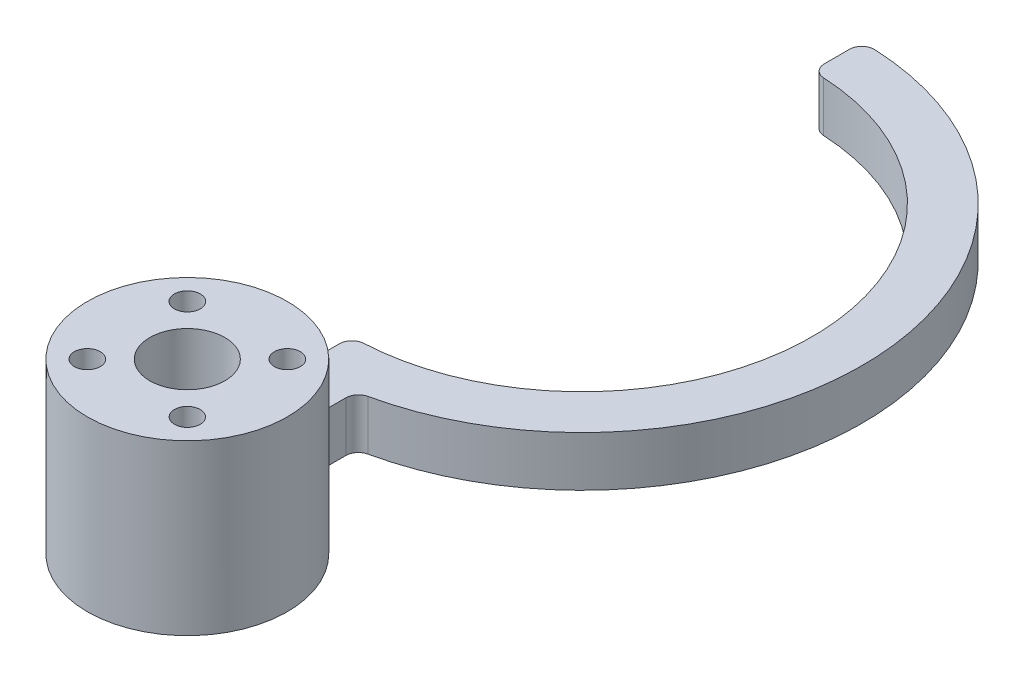
from build123d import *

# Parameters (mm, degrees)
SKETCH1_R           = 2.075
SKETCH1_R_2         = 6.003208263
BOSS_EXTRUDE2_DEPTH = 8
FILLET1_R           = 2
SKETCH2_R           = 16
SKETCH2_R_2         = 2.075
SKETCH2_R_3         = 6.003208263
SKETCH2_R_4         = 2.059067384
BOSS_EXTRUDE3_DEPTH = 19


with BuildPart() as part:
    # Sketch1 → Boss-Extrude2 (new body)
    with BuildSketch(Plane(origin=(0, 0, 0), x_dir=(1, 0, 0), z_dir=(0, 1, 0))):
        with BuildLine():
            Line((0, 44.83), (0, 36.83))
            ThreePointArc((0, 36.83), (36.83, 0), (0, -36.83))
            Line((0, -36.83), (0, -46.83))
            Line((0, -46.83), (0, -58.83))
            ThreePointArc((0, -58.83), (14.116701064, -87.229775601), (8, -56.110417137))
            Line((8, -56.110417137), (8, -44.110417137))
            ThreePointArc((8, -44.110417137), (44.649741882, 4.016148637), (0, 44.83))
        make_face()
        with Locations(Location((0.96696537, -64.081170969, 0), (0, 0, 270))):
            Circle(SKETCH1_R, mode=Mode.SUBTRACT)
        with Locations(Location((16.96696537, -64.081170969, 0), (0, 0, 270))):
            Circle(SKETCH1_R, mode=Mode.SUBTRACT)
        with Locations(Location((16.96696537, -80.081170969, 0), (0, 0, 270))):
            Circle(SKETCH1_R, mode=Mode.SUBTRACT)
        with Locations(Location((0.96696537, -80.081170969, 0), (0, 0, 270))):
            Circle(SKETCH1_R, mode=Mode.SUBTRACT)
        with Locations(Location((8.96696537, -72.081170969, 0), (0, 0, 270))):
            Circle(SKETCH1_R_2, mode=Mode.SUBTRACT)
    extrude(amount=BOSS_EXTRUDE2_DEPTH)

    # Fillet1
    fillet1_edges = [part.edges().sort_by_distance(p)[0] for p in [
        (0, 4, 58.83),
        (0, 4, 36.83),
        (0, 4, -36.83),
        (0, 4, -44.83),
        (8, 4, 44.110417137),
        (8, 4, 56.110417137),
    ]]
    fillet(fillet1_edges, radius=FILLET1_R)

    # Sketch2 → Boss-Extrude3 (add)
    with BuildSketch(Plane(origin=(0, 8, 0), x_dir=(1, 0, 0), z_dir=(0, 1, 0))):
        with Locations(Location((8.96696537, -72.081170969, 0), (0, 0, 86.709940875))):
            Circle(SKETCH2_R)
        with Locations(Location((0.96696537, -64.081170969, 0), (0, 0, 270))):
            Circle(SKETCH2_R_2, mode=Mode.SUBTRACT)
        with Locations(Location((8.96696537, -72.081170969, 0), (0, 0, 270))):
            Circle(SKETCH2_R_3, mode=Mode.SUBTRACT)
        with Locations(Location((16.96696537, -64.081170969, 0), (0, 0, 270))):
            Circle(SKETCH2_R_2, mode=Mode.SUBTRACT)
        with Locations(Location((16.96696537, -80.081170969, 0), (0, 0, 270))):
            Circle(SKETCH2_R_4, mode=Mode.SUBTRACT)
        with Locations(Location((0.96696537, -80.081170969, 0), (0, 0, 270))):
            Circle(SKETCH2_R_2, mode=Mode.SUBTRACT)
    extrude(amount=BOSS_EXTRUDE3_DEPTH)


solid = part.part
